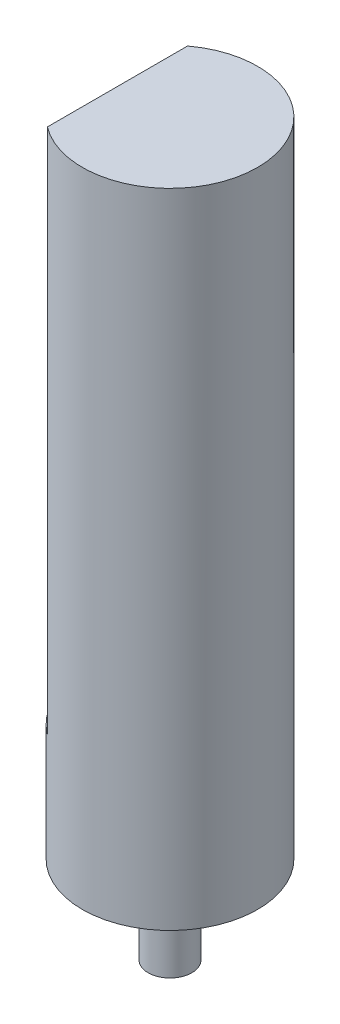
from build123d import *

# Parameters (mm, degrees)
SKETCH_1_R          = 1.5
EXTRUDE_1_DEPTH     = 11
CUT_EXTRUDE_START   = -9
CUT_EXTRUDE_1_DEPTH = 9
SKETCH_3_R          = 0.375
EXTRUDE_2_DEPTH     = 1.5


with BuildPart() as part:
    # Эскиз1 → Бобышка-Вытянуть1 (new body)
    with BuildSketch(Plane(origin=(0, 0, 0), x_dir=(1, 0, 0), z_dir=(0, 1, 0))):
        with Locations(Location((0, 0, 0), (0, 0, 270))):
            Circle(SKETCH_1_R)
    extrude(amount=EXTRUDE_1_DEPTH)

    # Эскиз2 → Вырез-Вытянуть1 (cut)
    with BuildSketch(Plane(origin=(0, 11, 0), x_dir=(1, 0, 0), z_dir=(0, 1, 0)).offset(CUT_EXTRUDE_START)):
        with BuildLine():
            Line((-0.9, -1.2), (-0.9, 1.2))
            ThreePointArc((-0.9, 1.2), (-1.5, 0), (-0.9, -1.2))
        make_face()
    extrude(amount=CUT_EXTRUDE_1_DEPTH, mode=Mode.SUBTRACT)

    # Эскиз3 → Бобышка-Вытянуть2 (add)
    with BuildSketch(Plane.XZ):
        with Locations(Location((0, 0, 0), (0, 0, 90))):
            Circle(SKETCH_3_R)
    extrude(amount=EXTRUDE_2_DEPTH)


solid = part.part
